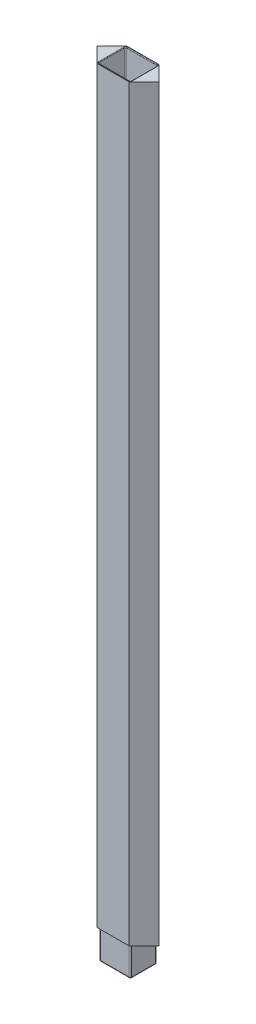
from build123d import *

# Parameters (mm, degrees)
BOSS_EXTRUDE2_DEPTH = 304.8
SKETCH3_W           = 12.7
SKETCH3_H           = 10.668
BOSS_EXTRUDE3_DEPTH = 12.192
FILLET1_R           = 0.508
SKETCH4_R           = 4.7625
CUT_EXTRUDE1_DEPTH  = 318.304868037
SKETCH5_W           = 13.208
SKETCH5_H           = 11.176
CUT_EXTRUDE2_DEPTH  = 12.7
FILLET3_R           = 0.381
FILLET4_R           = 0.254


with BuildPart() as part:
    # Sketch2 → Boss-Extrude2 (new body)
    with BuildSketch(Plane(origin=(0, 0, 0), x_dir=(1, 0, 0), z_dir=(0, 1, 0))):
        Polygon((-6.604, 6.096), (6.604, 6.096), (12.7, 0), (6.604, -6.096), (-6.604, -6.096), (-12.7, 0), align=None)
    extrude(amount=BOSS_EXTRUDE2_DEPTH)

    # Sketch3 → Boss-Extrude3 (add)
    with BuildSketch(Plane.XZ):
        Rectangle(SKETCH3_W, SKETCH3_H)
    extrude(amount=BOSS_EXTRUDE3_DEPTH)

    # Fillet1
    fillet1_edges = [part.edges().sort_by_distance(p)[0] for p in [
        (6.35, 0, 0),
        (6.35, -6.096, -5.334),
        (0, 0, 5.334),
        (6.35, -6.096, 5.334),
        (-6.35, 0, 0),
        (-6.35, -6.096, 5.334),
        (0, 0, -5.334),
        (-6.35, -6.096, -5.334),
        (6.35, -12.192, 0),
        (0, -12.192, 5.334),
        (-6.35, -12.192, 0),
        (0, -12.192, -5.334),
    ]]
    fillet(fillet1_edges, radius=FILLET1_R)

    # Sketch4 → Cut-Extrude1 (cut, through all)
    with BuildSketch(Plane(origin=(0, 304.8, 0), x_dir=(1, 0, 0), z_dir=(0, 1, 0))):
        with Locations(Location((0, 0, 0), (0, 0, 270))):
            Circle(SKETCH4_R)
    extrude(amount=-CUT_EXTRUDE1_DEPTH, mode=Mode.SUBTRACT)

    # Sketch5 → Cut-Extrude2 (cut)
    with BuildSketch(Plane(origin=(0, 304.8, 0), x_dir=(1, 0, 0), z_dir=(0, 1, 0))):
        Rectangle(SKETCH5_W, SKETCH5_H)
    extrude(amount=-CUT_EXTRUDE2_DEPTH, mode=Mode.SUBTRACT)

    # Fillet3
    fillet3_edges = [part.edges().sort_by_distance(p)[0] for p in [
        (6.604, 292.1, 0),
        (6.604, 298.45, -5.588),
        (0, 292.1, 5.588),
        (6.604, 298.45, 5.588),
        (-6.604, 292.1, 0),
        (-6.604, 298.45, 5.588),
        (0, 292.1, -5.588),
        (-6.604, 298.45, -5.588),
    ]]
    fillet(fillet3_edges, radius=FILLET3_R)

    # Fillet4
    fillet4_edges = [part.edges().sort_by_distance(p)[0] for p in [
        (0, 304.8, 5.588),
        (-6.604, 304.8, 0),
        (6.492407684, 304.8, -5.476407684),
        (6.492407684, 304.8, 5.476407684),
        (-6.492407684, 304.8, 5.476407684),
        (-6.492407684, 304.8, -5.476407684),
        (0, 304.8, -5.588),
        (6.604, 304.8, 0),
    ]]
    fillet(fillet4_edges, radius=FILLET4_R)


solid = part.part
